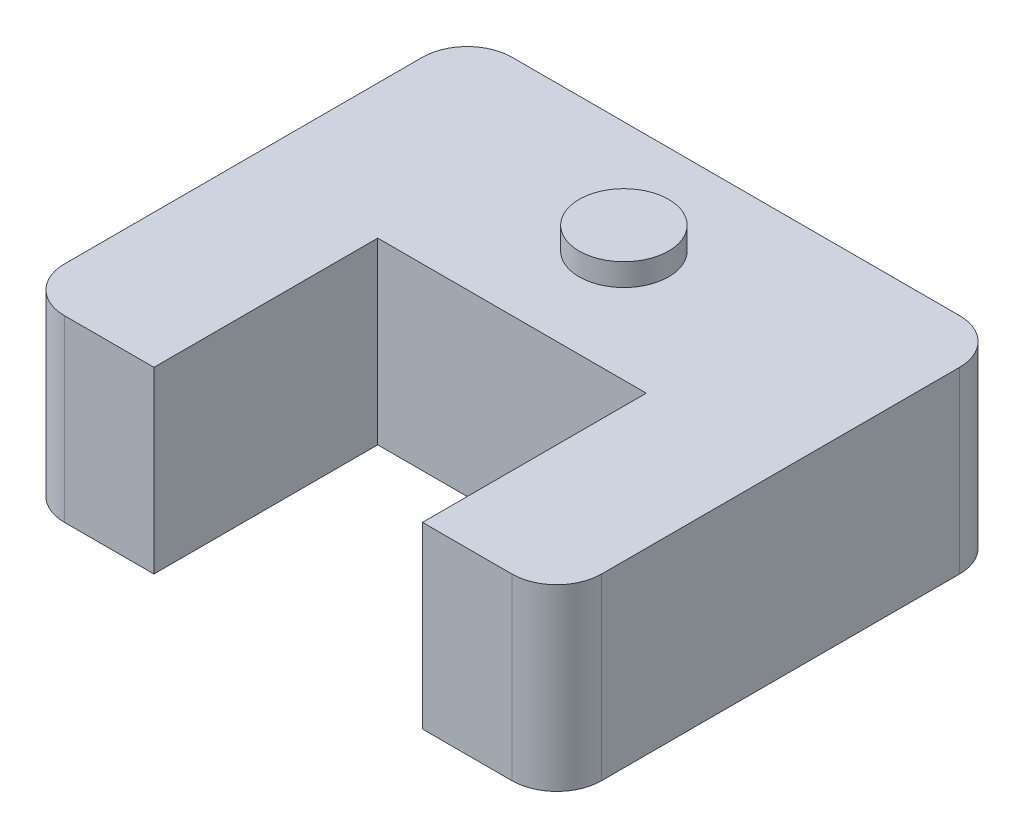
from build123d import *

# Parameters (mm, degrees)
SKETCH1_W           = 304.8
SKETCH1_H           = 101.6
BOSS_EXTRUDE1_DEPTH = 254
SKETCH3_W           = 152.4
SKETCH3_H           = 101.6
CUT_EXTRUDE1_DEPTH  = 127
FILLET1_R           = 25.4
SKETCH4_R           = 25.4
BOSS_EXTRUDE2_DEPTH = 12.7


with BuildPart() as part:
    # Sketch1 → Boss-Extrude1 (new body)
    with BuildSketch(Plane.XY):
        with Locations((-152.4, 50.8)):
            Rectangle(SKETCH1_W, SKETCH1_H)
    extrude(amount=-BOSS_EXTRUDE1_DEPTH)

    # Sketch3 → Cut-Extrude1 (cut)
    with BuildSketch(Plane.XY):
        with Locations((-152.4, 50.8)):
            Rectangle(SKETCH3_W, SKETCH3_H)
    extrude(amount=-CUT_EXTRUDE1_DEPTH, mode=Mode.SUBTRACT)

    # Fillet1
    fillet1_edges = [part.edges().sort_by_distance(p)[0] for p in [
        (0, 50.8, -254),
        (0, 50.8, 0),
        (-304.8, 50.8, 0),
        (-304.8, 50.8, -254),
    ]]
    fillet(fillet1_edges, radius=FILLET1_R)

    # Sketch4 → Boss-Extrude2 (add)
    with BuildSketch(Plane(origin=(0, 101.6, 0), x_dir=(1, 0, 0), z_dir=(0, 1, 0))):
        with Locations(Location((-152.4, 190.5, 0), (0, 0, 270))):
            Circle(SKETCH4_R)
    extrude(amount=BOSS_EXTRUDE2_DEPTH)


solid = part.part
